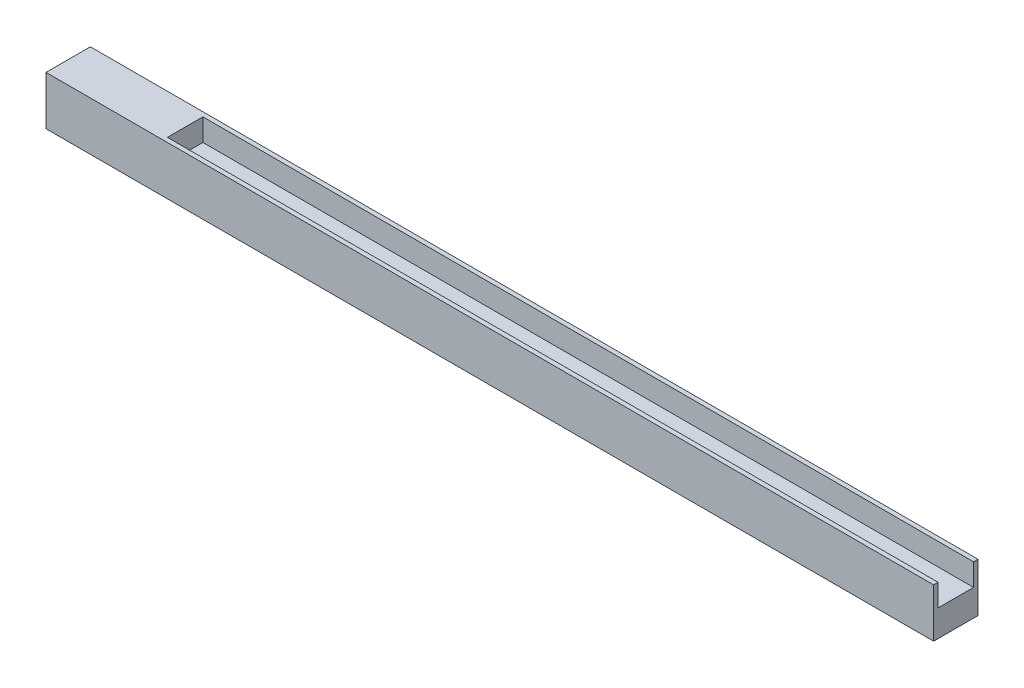
from build123d import *

# Parameters (mm, degrees)
SKETCH1_W           = 254
SKETCH1_H           = 13.97
BOSS_EXTRUDE1_DEPTH = 12.7
SKETCH2_W           = 220.536076876
SKETCH2_H           = 10.16
CUT_EXTRUDE2_DEPTH  = 6.35


with BuildPart() as part:
    # Sketch1 → Boss-Extrude1 (new body)
    with BuildSketch(Plane.XY):
        with Locations((127, -6.985)):
            Rectangle(SKETCH1_W, SKETCH1_H)
    extrude(amount=BOSS_EXTRUDE1_DEPTH)

    # Sketch2 → Cut-Extrude2 (cut)
    with BuildSketch(Plane(origin=(0, 0, 0), x_dir=(1, 0, 0), z_dir=(0, 1, 0))):
        with Locations((143.731961562, -6.35)):
            Rectangle(SKETCH2_W, SKETCH2_H)
    extrude(amount=-CUT_EXTRUDE2_DEPTH, mode=Mode.SUBTRACT)


solid = part.part
